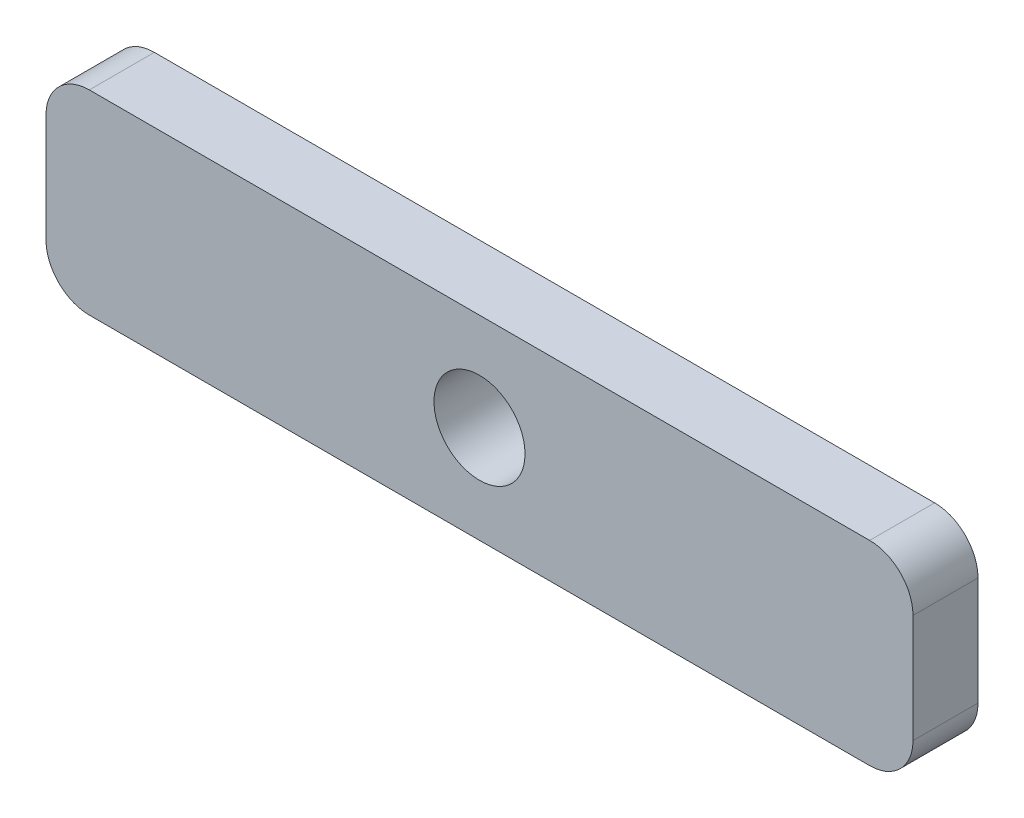
from build123d import *

# Parameters (mm, degrees)
SKETCH_1_W      = 40
SKETCH_1_H      = 9
SKETCH_1_R      = 2.1
EXTRUDE_1_DEPTH = 3
FILLET_1_R      = 2


with BuildPart() as part:
    # 草图1 → 凸台-拉伸1 (new body)
    with BuildSketch(Plane.XY):
        Rectangle(SKETCH_1_W, SKETCH_1_H)
        Circle(SKETCH_1_R, mode=Mode.SUBTRACT)
    extrude(amount=EXTRUDE_1_DEPTH)

    # 圆角1
    fillet_1_edges = [part.edges().sort_by_distance(p)[0] for p in [
        (-20, 4.5, 1.5),
        (20, 4.5, 1.5),
        (20, -4.5, 1.5),
        (-20, -4.5, 1.5),
    ]]
    fillet(fillet_1_edges, radius=FILLET_1_R)


solid = part.part
